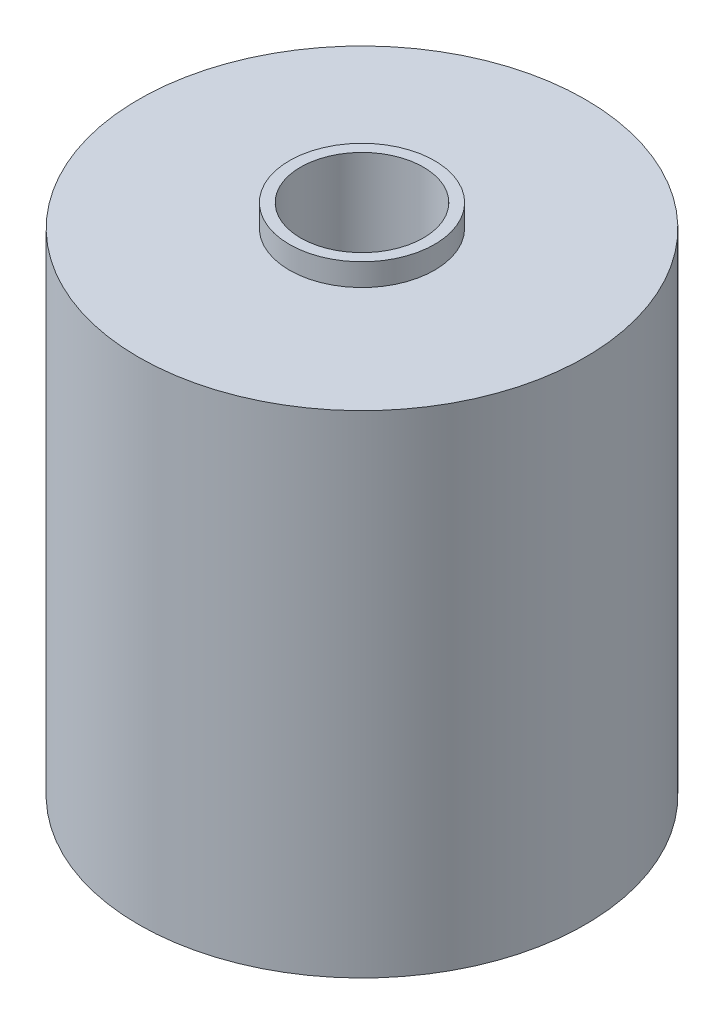
from build123d import *

# Parameters (mm, degrees)
ESBO_O1_R                = 10
ESBO_O1_R_2              = 3.25
RESSALTO_EXTRUS_O1_DEPTH = 11
ESBO_O1_3_R              = 3.25
ESBO_O1_3_R_2            = 2.75
RESSALTO_EXTRUS_O2_DEPTH = 12


with BuildPart() as part:
    # Esboço1 → Ressalto-extrusão1 (new, symmetric)
    with BuildSketch(Plane(origin=(0, 0, 0), x_dir=(1, 0, 0), z_dir=(0, 1, 0))):
        Circle(ESBO_O1_R)
        Circle(ESBO_O1_R_2, mode=Mode.SUBTRACT)
    extrude(amount=RESSALTO_EXTRUS_O1_DEPTH, both=True)

    # Esboço1<3> → Ressalto-extrusão2 (add, symmetric)
    with BuildSketch(Plane(origin=(0, 0, 0), x_dir=(1, 0, 0), z_dir=(0, 1, 0))):
        Circle(ESBO_O1_3_R)
        Circle(ESBO_O1_3_R_2, mode=Mode.SUBTRACT)
    extrude(amount=RESSALTO_EXTRUS_O2_DEPTH, both=True)


solid = part.part
